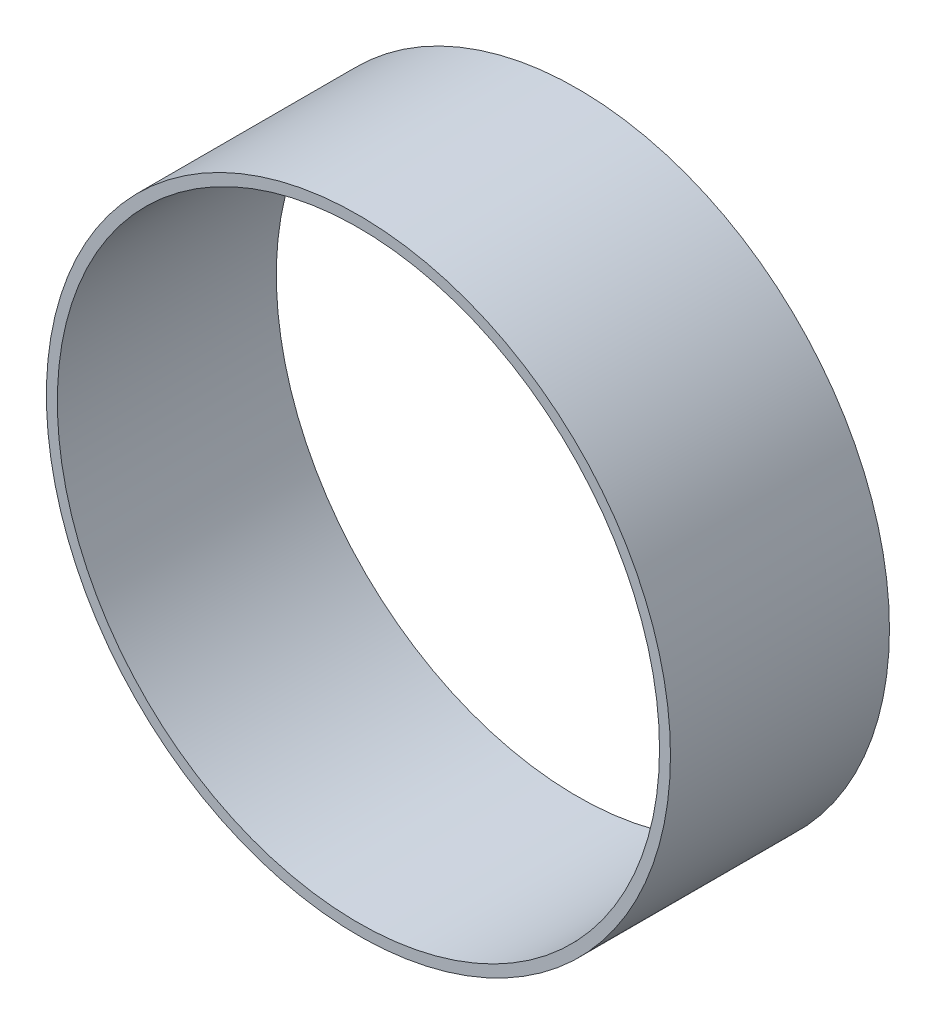
from build123d import *

# Parameters (mm, degrees)
SKETCH1_R           = 57
SKETCH1_R_2         = 55
BOSS_EXTRUDE1_DEPTH = 40


with BuildPart() as part:
    # Sketch1 → Boss-Extrude1 (new body)
    with BuildSketch(Plane.XY):
        Circle(SKETCH1_R)
        Circle(SKETCH1_R_2, mode=Mode.SUBTRACT)
    extrude(amount=BOSS_EXTRUDE1_DEPTH)


solid = part.part
